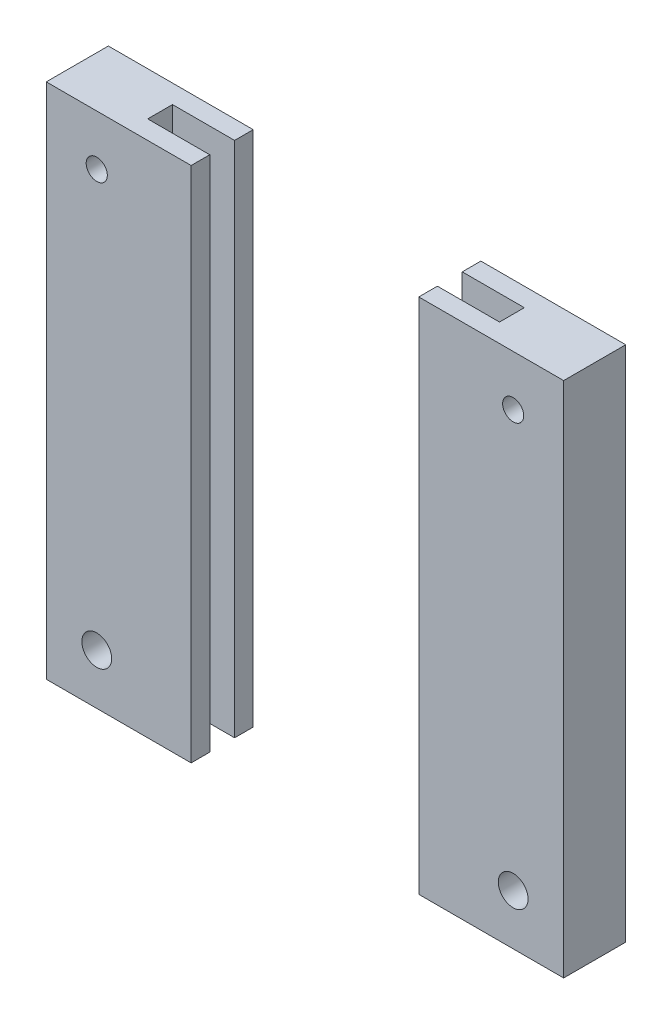
from build123d import *

# Parameters (mm, degrees)
SKETCH1_W          = 125
SKETCH1_H          = 125
PLATE_DEPTH        = 15
SKETCH2_W          = 15
SKETCH2_H          = 6
CUT_EXTRUDE1_DEPTH = 178.411949992
SKETCH3_W          = 55
SKETCH3_H          = 15
CUT_EXTRUDE2_DEPTH = 178.411949992
SKETCH4_R          = 3.6
SKETCH4_R_2        = 2.55
CUT_EXTRUDE3_DEPTH = 178.411949992


with BuildPart() as part:
    # Sketch1 → Plate (new body)
    with BuildSketch(Plane.XY):
        with Locations((62.5, 62.5)):
            Rectangle(SKETCH1_W, SKETCH1_H)
    extrude(amount=PLATE_DEPTH)

    # Sketch2 → Cut-Extrude1 (cut, symmetric)
    with BuildSketch(Plane(origin=(0, 125, 0), x_dir=(1, 0, 0), z_dir=(0, 1, 0))):
        with Locations((27.5, -7.5)):
            Rectangle(SKETCH2_W, SKETCH2_H)
    cut_extrude1 = extrude(amount=CUT_EXTRUDE1_DEPTH, both=True, mode=Mode.SUBTRACT)

    # Mirror1: Cut-Extrude1 across plane
    add(cut_extrude1.mirror(Plane(origin=(62.5, 0, 0), x_dir=(0, 0, 1), z_dir=(1, 0, 0))), mode=Mode.SUBTRACT)

    # Sketch3 → Cut-Extrude2 (cut, through all)
    with BuildSketch(Plane(origin=(0, 125, 0), x_dir=(1, 0, 0), z_dir=(0, 1, 0))):
        with Locations((62.5, -7.5)):
            Rectangle(SKETCH3_W, SKETCH3_H)
    extrude(amount=-CUT_EXTRUDE2_DEPTH, mode=Mode.SUBTRACT)


with BuildPart() as cut_extrude2_piece_1:
    # of the separate pieces the step leaves, piece 1, a body of its own (cut_extrude2_pieces)
    add(part.part.solids().sort_by_distance((0, 0, 0))[0])


with BuildPart() as cut_extrude2_piece_2:
    # of the separate pieces the step leaves, piece 2, a body of its own (cut_extrude2_pieces)
    add(part.part.solids().sort_by_distance((90, 0, 0))[0])

    # Sketch4 → Cut-Extrude3 (cut, symmetric)
    with BuildSketch(Plane(origin=(0, 0, 0), x_dir=(-1, 0, 0), z_dir=(0, 0, -1))):
        with Locations((-112.8, 12.2)):
            Circle(SKETCH4_R)
        with Locations((-112.8, 112.8)):
            Circle(SKETCH4_R_2)
    cut_extrude3 = extrude(amount=CUT_EXTRUDE3_DEPTH, both=True, mode=Mode.SUBTRACT)


with BuildPart() as cut_extrude2_piece_1_1:
    add(cut_extrude2_piece_1.part)

    # Mirror2: Cut-Extrude3 across plane
    add(cut_extrude3.mirror(Plane(origin=(62.5, 0, 0), x_dir=(0, 0, 1), z_dir=(1, 0, 0))), mode=Mode.SUBTRACT)


solid = Compound([cut_extrude2_piece_2.part, cut_extrude2_piece_1_1.part])
